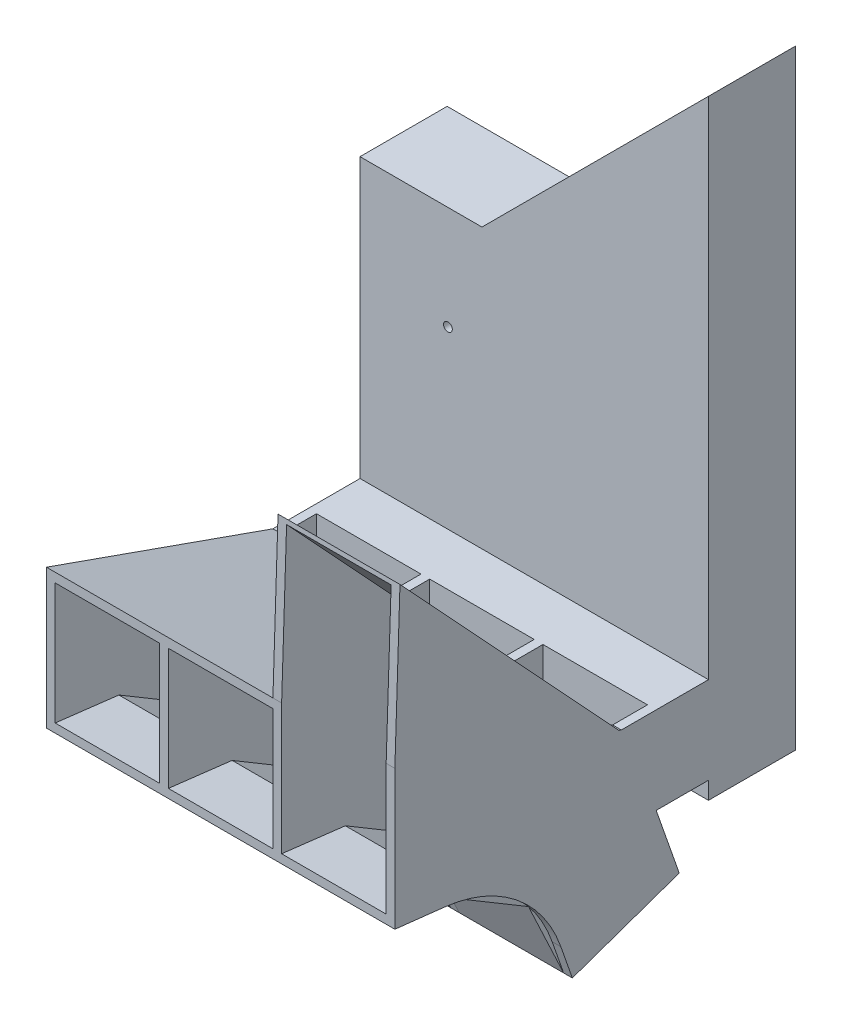
from build123d import *

# Parameters (mm, degrees)
P_IDAT_VYSUNUT_M1_DEPTH  = 50
SKICA7_W                 = 200
SKICA7_H                 = 50
P_IDAT_VYSUNUT_M5_DEPTH  = 30
P_IDAT_VYSUNUT_M6_DEPTH  = 5
LINPOLE1_COUNT           = 4
LINPOLE1_PITCH           = 65
P_IDAT_VYSUNUT_M10_DEPTH = 60
LINPOLE3_COUNT           = 3
LINPOLE3_PITCH           = 65
SKICA17_W                = 60
SKICA17_H                = 132.33
ODEBRAT_VYSUNUT_M3_DEPTH = 10
P_IDAT_VYSUNUT_M12_DEPTH = 5
LINPOLE4_COUNT           = 2
LINPOLE4_PITCH           = 65
P_IDAT_VYSUNUT_M13_DEPTH = 60
SKICA20_R                = 2.5
ODEBRAT_VYSUNUT_M4_DEPTH = 10


with BuildPart() as part:
    # Skica1 → Přidat vysunutím1 (new body)
    with BuildSketch(Plane.XY):
        Polygon((0, 0), (200, 0), (200, 350), (70, 220), (0, 220), align=None)
    extrude(amount=P_IDAT_VYSUNUT_M1_DEPTH)

    # Skica7 → Přidat vysunutím5 (add)
    with BuildSketch(Plane.XY.offset(50)):
        with Locations((100, 35)):
            Rectangle(SKICA7_W, SKICA7_H)
    extrude(amount=P_IDAT_VYSUNUT_M5_DEPTH)

    # Skica9 → Přidat vysunutím6 (add)
    with BuildSketch(Plane.ZY):
        with BuildLine():
            Line((80, 10), (66.774778957, -27.75041097))
            Line((66.774778957, -27.75041097), (128.119196783, -49.241395164))
            Line((128.119196783, -49.241395164), (134.731807304, -30.366189679))
            ThreePointArc((134.731807304, -30.366189679), (160.364777666, 5.738922578), (201.274673199, 22.680255114))
            Line((201.274673199, 22.680255114), (230, 25.917114128))
            Line((230, 25.917114128), (230, 105.917114128))
            Line((230, 105.917114128), (100, 60))
            Line((100, 60), (80, 60))
            Line((80, 60), (80, 10))
        make_face()
    p_idat_vysunut_m6 = extrude(amount=-P_IDAT_VYSUNUT_M6_DEPTH)

    # LinPole1: Přidat vysunutím6 ×4
    with Locations(*[(i * LINPOLE1_PITCH, 0, 0) for i in range(1, LINPOLE1_COUNT)]):
        add(p_idat_vysunut_m6)

    # Skica12 → Přidat vysunutím10 (add)
    with BuildSketch(Plane(origin=(5, 0, 0), x_dir=(0, 0, -1), z_dir=(1, 0, 0))):
        Polygon((-230, 105.917114128), (-230, 100.61438772), (-105.220267206, 56.541116708), (-71.496803297, -29.404692713), (-66.774778957, -27.75041097), (-101.40042077, 60.494640618), align=None)
        Polygon((-230, 25.917114128), (-230, 30.952852669), (-193.421577993, 26.571602615), (-144.481791005, -2.596155027), (-123.37587339, -47.579651656), (-128.119196783, -49.241395164), (-148.357587613, -6.10687705), (-195.069843452, 21.733288203), align=None)
    p_idat_vysunut_m10 = extrude(amount=P_IDAT_VYSUNUT_M10_DEPTH)

    # LinPole3: Přidat vysunutím10 ×3
    with Locations(*[(i * LINPOLE3_PITCH, 0, 0) for i in range(1, LINPOLE3_COUNT)]):
        add(p_idat_vysunut_m10)

    # Skica17 → Odebrat vysunutím3 (cut)
    with BuildSketch(Plane(origin=(0, 21.941769172, -7.750020917), x_dir=(1, 0, 0), z_dir=(0, 0.9429111773554218, -0.33304430879120595))):
        with Locations((165, -185.979662856)):
            Rectangle(SKICA17_W, SKICA17_H)
    extrude(amount=-ODEBRAT_VYSUNUT_M3_DEPTH, mode=Mode.SUBTRACT)

    # Skica18 → Přidat vysunutím12 (add)
    with BuildSketch(Plane(origin=(135, 0, 0), x_dir=(0, 0, -1), z_dir=(1, 0, 0))):
        Polygon((-101.40042077, 60.494640618), (-227.071424446, 195.869453982), (-230, 105.917114128), align=None)
    p_idat_vysunut_m12 = extrude(amount=-P_IDAT_VYSUNUT_M12_DEPTH)

    # LinPole4: Přidat vysunutím12 ×2
    with Locations(*[(i * LINPOLE4_PITCH, 0, 0) for i in range(1, LINPOLE4_COUNT)]):
        add(p_idat_vysunut_m12)

    # Skica19 → Přidat vysunutím13 (add)
    with BuildSketch(Plane(origin=(135, 0, 0), x_dir=(0, 0, -1), z_dir=(1, 0, 0))):
        Polygon((-227.071424446, 195.869453982), (-101.40042077, 60.494640618), (-105.224563901, 61.845360745), (-227.158510983, 193.194557029), align=None)
    extrude(amount=P_IDAT_VYSUNUT_M13_DEPTH)

    # Skica20 → Odebrat vysunutím4 (cut)
    with BuildSketch(Plane.XY.offset(50)):
        with Locations((50.459484354, 160.603206666)):
            Circle(SKICA20_R)
    extrude(amount=-ODEBRAT_VYSUNUT_M4_DEPTH, mode=Mode.SUBTRACT)


solid = part.part
